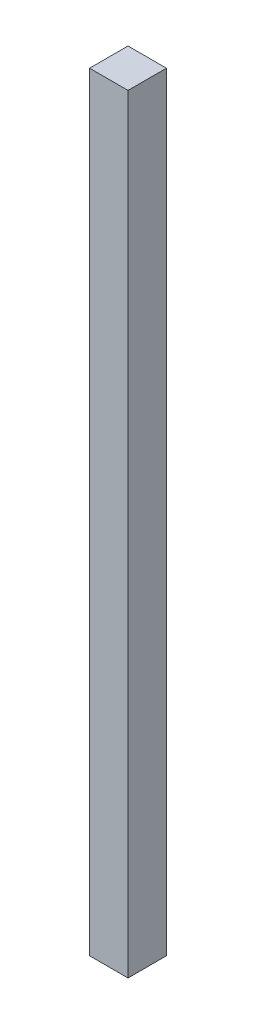
from build123d import *

# Parameters (mm, degrees)
SKETCH1_W           = 20
SKETCH1_H           = 20
BOSS_EXTRUDE1_DEPTH = 400


with BuildPart() as part:
    # Sketch1 → Boss-Extrude1 (new body)
    with BuildSketch(Plane(origin=(0, 0, 0), x_dir=(1, 0, 0), z_dir=(0, 1, 0))):
        Rectangle(SKETCH1_W, SKETCH1_H)
    extrude(amount=BOSS_EXTRUDE1_DEPTH)


solid = part.part
